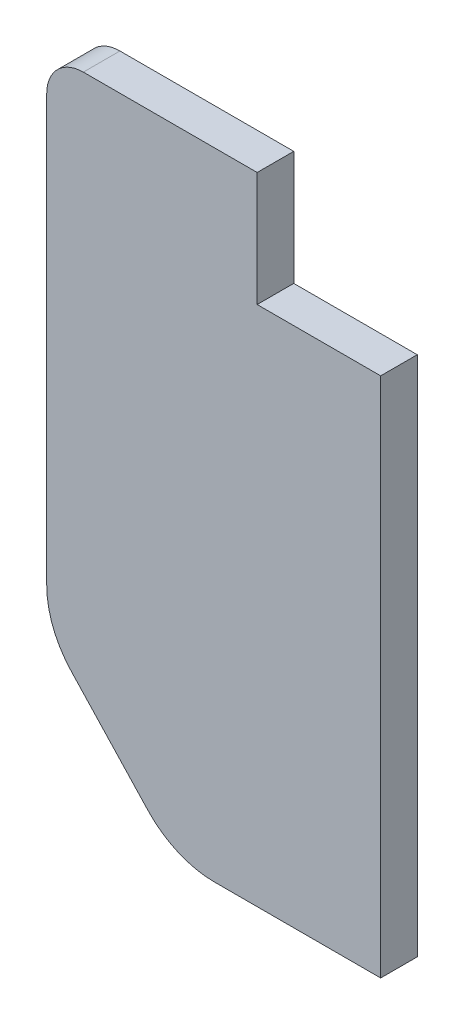
from build123d import *

# Parameters (mm, degrees)
EXTRUDE_1_DEPTH = 8
FILLET_1_R      = 8
FILLET_2_R      = 20


with BuildPart() as part:
    # 草图1 → 凸台-拉伸1 (new body)
    with BuildSketch(Plane.XY):
        Polygon((0, 0), (0, 114), (-27, 114), (-27, 139), (-73, 139), (-73, 30), (-45, 0), align=None)
    extrude(amount=EXTRUDE_1_DEPTH)

    # 圆角1
    fillet_1_edges = [part.edges().sort_by_distance(p)[0] for p in [
        (-73, 139, 4),
    ]]
    fillet(fillet_1_edges, radius=FILLET_1_R)

    # 圆角2
    fillet_2_edges = [part.edges().sort_by_distance(p)[0] for p in [
        (-45, 0, 4),
        (-73, 30, 4),
    ]]
    fillet(fillet_2_edges, radius=FILLET_2_R)


solid = part.part
